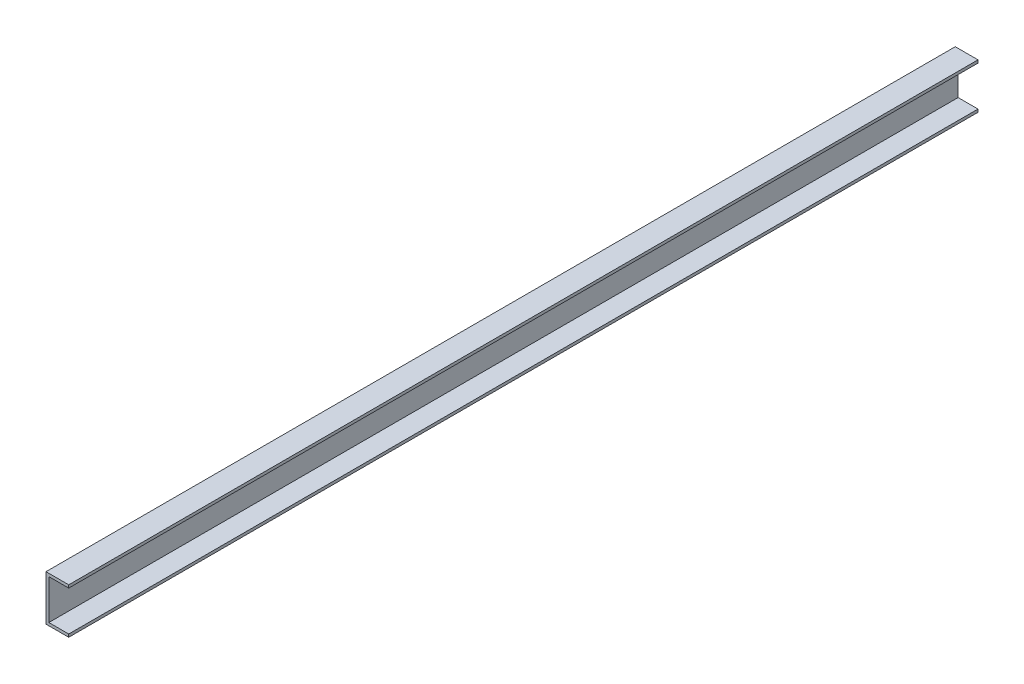
from build123d import *

# Parameters (mm, degrees)
EXTRUDE1_DEPTH = 1016


with BuildPart() as part:
    # Sketch1 → Extrude1 (new body)
    with BuildSketch(Plane.XY):
        Polygon((0, 0), (0, 50.8), (25.4, 50.8), (25.4, 47.625), (3.175, 47.625), (3.175, 3.175), (25.4, 3.175), (25.4, 0), align=None)
    extrude(amount=EXTRUDE1_DEPTH)


solid = part.part
